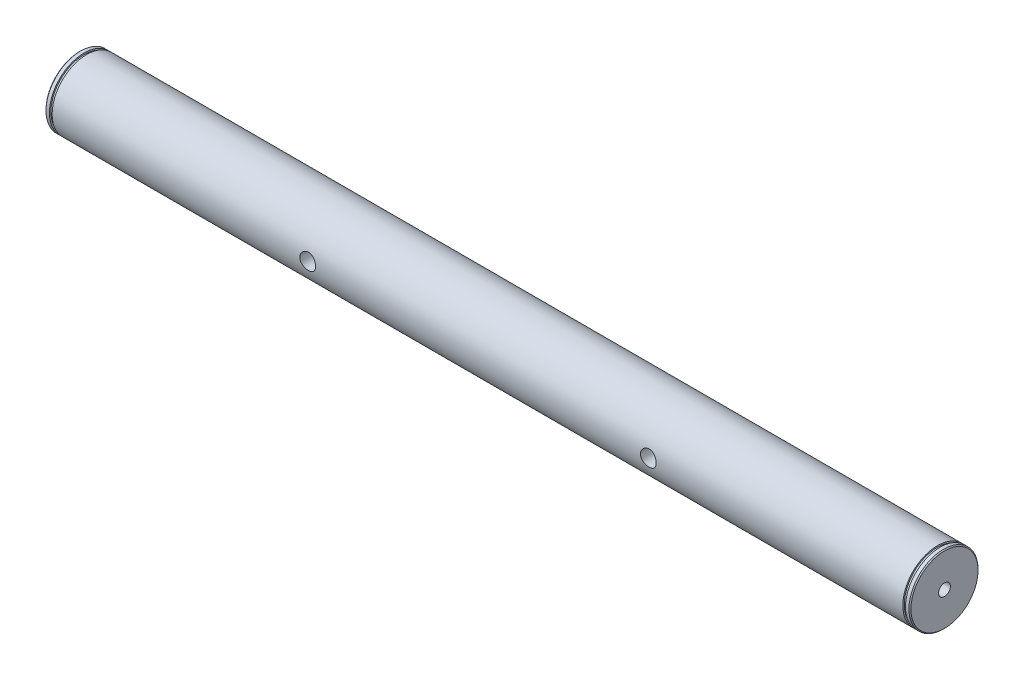
from build123d import *

# Parameters (mm, degrees)
HOLE_WIZARD_16_0_16_2_D     = 16
HOLE_WIZARD_16_0_16_2_DEPTH = 15
HOLE_WIZARD_16_0_16_2_TIP   = 4.806884952
HOLE_WIZARD_M14_1_D         = 12
HOLE_WIZARD_M14_1_DEPTH     = 30
HOLE_WIZARD_M14_1_TIP       = 3.605163714
CHAMFER_1_SIZE              = 1


with BuildPart() as part:
    # 草图1 → 旋转1 (revolve)
    with BuildSketch(Plane.XY, mode=Mode.PRIVATE) as revolve_1_sk:
        Polygon((0, 0), (0, 35), (4.5, 35), (4.5, 33.5), (7.2, 33.5), (7.2, 35), (868.8, 35), (868.8, 33.5), (871.5, 33.5), (871.5, 35), (876, 35), (876, 0), align=None)
    revolve(revolve_1_sk.sketch.rotate(Axis((0, 0, 0), (1, 0, 0)), 90), axis=Axis((0, 0, 0), (1, 0, 0)))

    # Ø16.0 (16) 直径孔2
    with Locations(Plane.XY.offset(35)):
        with Locations((266, 0), (611, 0)):
            Hole(HOLE_WIZARD_16_0_16_2_D / 2, depth=HOLE_WIZARD_16_0_16_2_DEPTH)
            with Locations((0, 0, -(HOLE_WIZARD_16_0_16_2_DEPTH + HOLE_WIZARD_16_0_16_2_TIP / 2))):  # 118° drill point
                Cone(0, HOLE_WIZARD_16_0_16_2_D / 2, HOLE_WIZARD_16_0_16_2_TIP, mode=Mode.SUBTRACT)

    # M14 螺纹孔1
    with Locations(Plane(origin=(876, 0, 0), x_dir=(0, 0, 1), z_dir=(1, 0, 0))):
        with Locations((0, 0)):
            Hole(HOLE_WIZARD_M14_1_D / 2, depth=HOLE_WIZARD_M14_1_DEPTH)
            with Locations((0, 0, -(HOLE_WIZARD_M14_1_DEPTH + HOLE_WIZARD_M14_1_TIP / 2))):  # 118° drill point
                Cone(0, HOLE_WIZARD_M14_1_D / 2, HOLE_WIZARD_M14_1_TIP, mode=Mode.SUBTRACT)

    # 倒角1
    chamfer_1_edges = [part.edges().sort_by_distance(p)[0] for p in [
        (0, 0, -35),
        (876, 0, -35),
    ]]
    chamfer(chamfer_1_edges, length=CHAMFER_1_SIZE)


solid = part.part
